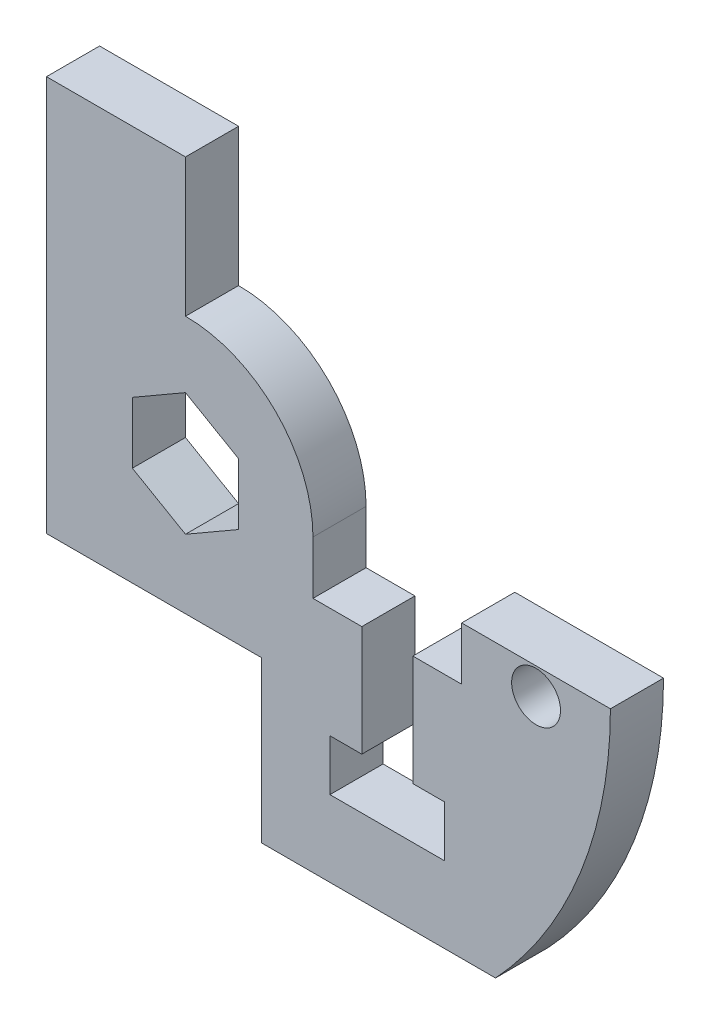
from build123d import *

# Parameters (mm, degrees)
SKETCH1_R           = 1.4605
BOSS_EXTRUDE1_DEPTH = 3.175
CUT_EXTRUDE1_REACH  = 105.107
CUT_EXTRUDE2_REACH  = 105.107
SKETCH4_W           = 25.4
SKETCH4_H           = 7.62
CUT_EXTRUDE3_DEPTH  = 36.774302562


with BuildPart() as part:
    # Sketch1 → Boss-Extrude1 (new body)
    with BuildSketch(Plane.XY):
        with BuildLine():
            Line((0, 7.62), (0, 25.4))
            ThreePointArc((0, 25.4), (-17.960512242, -17.960512242), (25.4, 0))
            Line((25.4, 0), (16.51, 0))
            Line((16.51, 0), (16.51, -3.175))
            Line((16.51, -3.175), (13.589, -3.175))
            Line((13.589, -3.175), (13.589, -9.779))
            Line((13.589, -9.779), (15.494, -9.779))
            Line((15.494, -9.779), (15.494, -12.827))
            Line((15.494, -12.827), (13.589, -12.827))
            Line((13.589, -12.827), (10.541, -12.827))
            Line((10.541, -12.827), (8.636, -12.827))
            Line((8.636, -12.827), (8.636, -9.779))
            Line((8.636, -9.779), (10.541, -9.779))
            Line((10.541, -9.779), (10.541, -3.175))
            Line((10.541, -3.175), (7.62, -3.175))
            Line((7.62, -3.175), (7.62, 0))
            ThreePointArc((7.62, 0), (5.388153673, 5.388153673), (0, 7.62))
        make_face()
        with Locations((20.955, -1.5875)):
            Circle(SKETCH1_R, mode=Mode.SUBTRACT)
        Polygon((3.175, 1.833087105), (3.175, -1.833087105), (0, -3.666174209), (-3.175, -1.833087105), (-3.175, 1.833087105), (0, 3.666174209), align=None, mode=Mode.SUBTRACT)
    extrude(amount=BOSS_EXTRUDE1_DEPTH)

    # Sketch2 → Cut-Extrude1 (cut, up to next)
    with BuildSketch(Plane(origin=(0, 0, -93.472), x_dir=(-1, 0, 0), z_dir=(0, 0, -1)), mode=Mode.PRIVATE) as cut_extrude1_sk1:
        Polygon((-4.538711403, -7.782479393), (27.834438784, -7.782479393), (16.089332095, -38.12601526), (-4.538711403, -36.427419359), align=None)
    cut_extrude1_tool1 = extrude(cut_extrude1_sk1.sketch, amount=-CUT_EXTRUDE1_REACH, mode=Mode.PRIVATE) & part.part
    add(cut_extrude1_tool1.solids().sort_by_distance((-9.075281, -21.483297, -93.472))[0], mode=Mode.SUBTRACT)

    # Sketch3 → Cut-Extrude2 (cut, up to next)
    with BuildSketch(Plane(origin=(0, 0, -93.472), x_dir=(-1, 0, 0), z_dir=(0, 0, -1)), mode=Mode.PRIVATE) as cut_extrude2_sk1:
        Polygon((8.30871298, -7.782479393), (8.30871298, 15.866972004), (0, 15.866972004), (0, 32.212276886), (53.906645957, 11.420627768), (19.587788586, -19.264211479), align=None)
    cut_extrude2_tool1 = extrude(cut_extrude2_sk1.sketch, amount=-CUT_EXTRUDE2_REACH, mode=Mode.PRIVATE) & part.part
    add(cut_extrude2_tool1.solids().sort_by_distance((-22.758535, 7.548852, -93.472))[0], mode=Mode.SUBTRACT)

    # Sketch4 → Cut-Extrude3 (cut, through all)
    with BuildSketch(Plane(origin=(0, 0, 0), x_dir=(-1, 0, 0), z_dir=(0, 0, -1))):
        with Locations((-17.238711403, -21.181200427)):
            Rectangle(SKETCH4_W, SKETCH4_H)
    extrude(amount=-CUT_EXTRUDE3_DEPTH, mode=Mode.SUBTRACT)


solid = part.part
